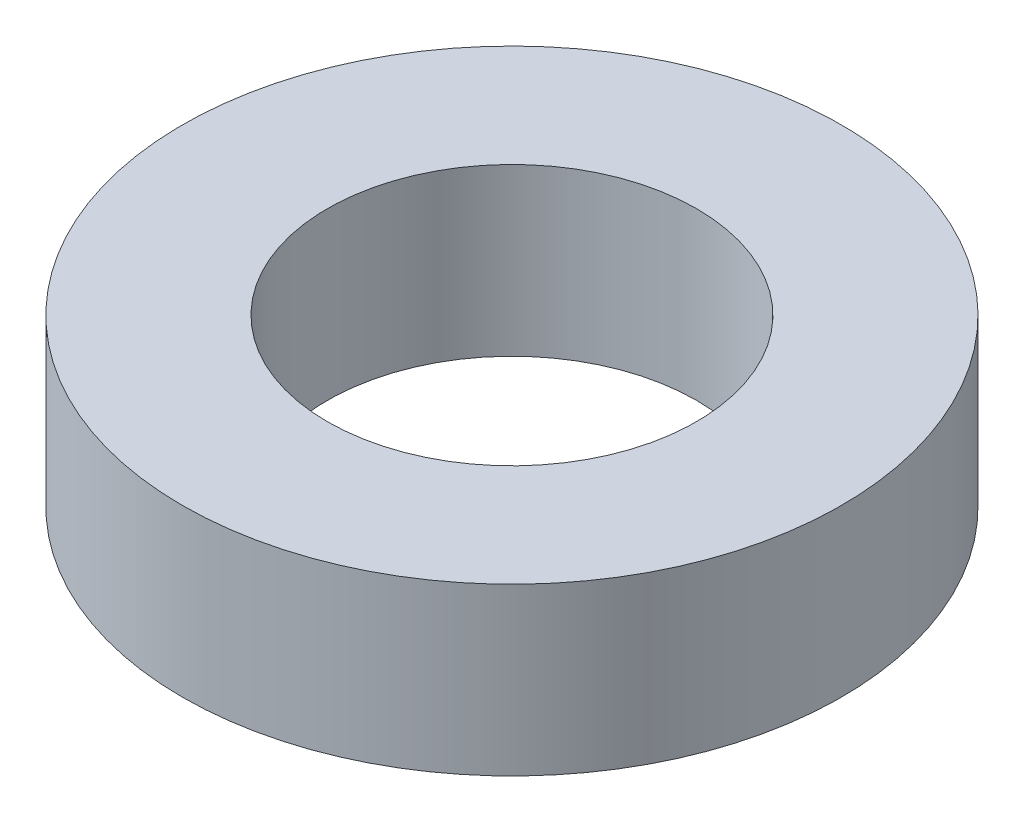
from build123d import *

# Parameters (mm, degrees)
SKETCH1_R           = 3.175
SKETCH1_R_2         = 1.778
BOSS_EXTRUDE1_DEPTH = 1.6


with BuildPart() as part:
    # Sketch1 → Boss-Extrude1 (new body)
    with BuildSketch(Plane(origin=(0, 0, 0), x_dir=(1, 0, 0), z_dir=(0, 1, 0))):
        with Locations(Location((0, 0, 0), (0, 0, 270))):
            Circle(SKETCH1_R)
        with Locations(Location((0, 0, 0), (0, 0, 270))):
            Circle(SKETCH1_R_2, mode=Mode.SUBTRACT)
    extrude(amount=BOSS_EXTRUDE1_DEPTH)


solid = part.part
